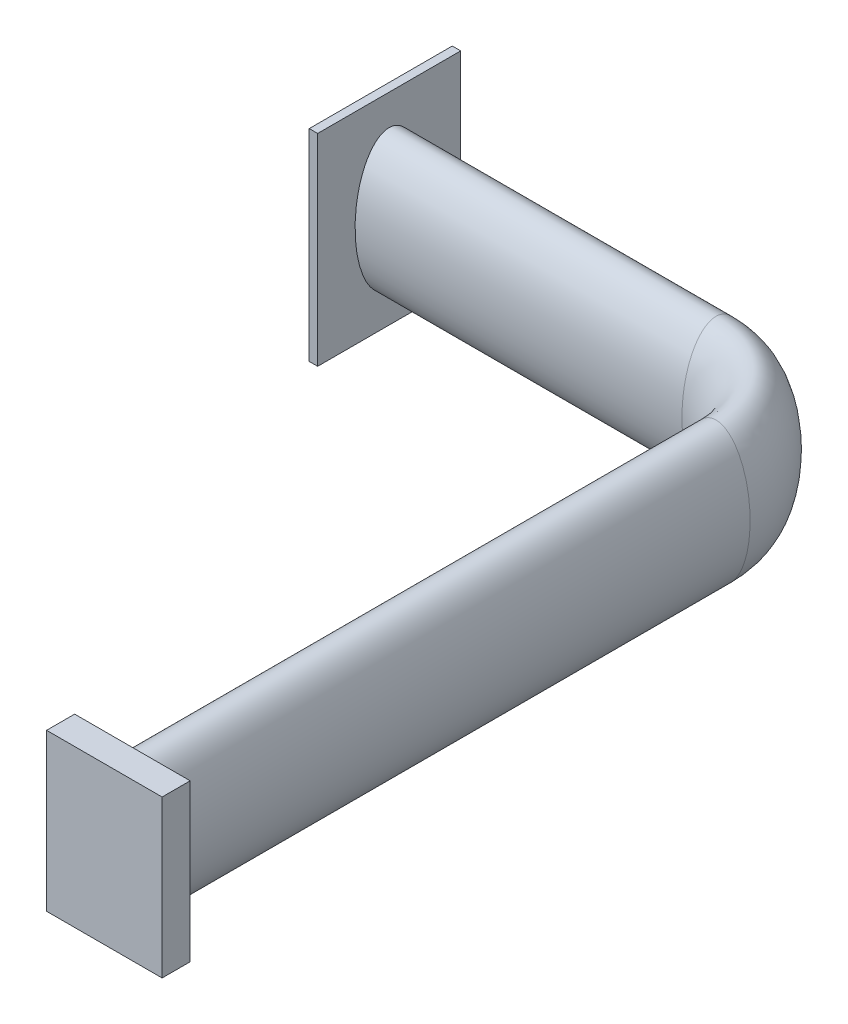
from build123d import *

# Parameters (mm, degrees)
SKETCH1_RX          = 63.5
SKETCH1_RY          = 30.876146789
SHELL1_T            = -4.4958
SKETCH3_W           = 104.57908048
SKETCH3_H           = 141.89788056
BOSS_EXTRUDE1_DEPTH = 25.4
SKETCH4_W           = 129.474643476
SKETCH4_H           = 182.59035826
BOSS_EXTRUDE2_DEPTH = 7.62


with BuildPart() as part:
    # Sweep1: sweep along a path in Sketch2
    with BuildLine(Plane(origin=(0, 0, 0), x_dir=(1, 0, 0), z_dir=(0, 1, 0))) as sweep1_path:
        Line((0, 0), (0, 528.32))
        ThreePointArc((0, 528.32), (-23.806360825, 585.793639175), (-81.28, 609.6))
        Line((-81.28, 609.6), (-377.172973744, 609.6))
    # Sketch1 → Sweep1 (sweep)
    with BuildSketch(Plane.XY):
        with Locations(Location((0, 0), (0, 0, 90))):
            Ellipse(SKETCH1_RX, SKETCH1_RY)
    sweep(path=sweep1_path.line)

    # Shell1
    shell1_openings = [part.faces().sort_by_distance(p)[0] for p in [
        (-377.172973744, 0, -609.6),
        (0, 0, 0),
    ]]
    offset(amount=SHELL1_T, openings=shell1_openings, kind=Kind.INTERSECTION)

    # Sketch3 → Boss-Extrude1 (add)
    with BuildSketch(Plane.XY):
        Rectangle(SKETCH3_W, SKETCH3_H)
    extrude(amount=BOSS_EXTRUDE1_DEPTH)

    # Sketch4 → Boss-Extrude2 (add)
    with BuildSketch(Plane.ZY.offset(377.172973744)):
        with Locations((-609.6, 0)):
            Rectangle(SKETCH4_W, SKETCH4_H)
    extrude(amount=BOSS_EXTRUDE2_DEPTH)


solid = part.part
